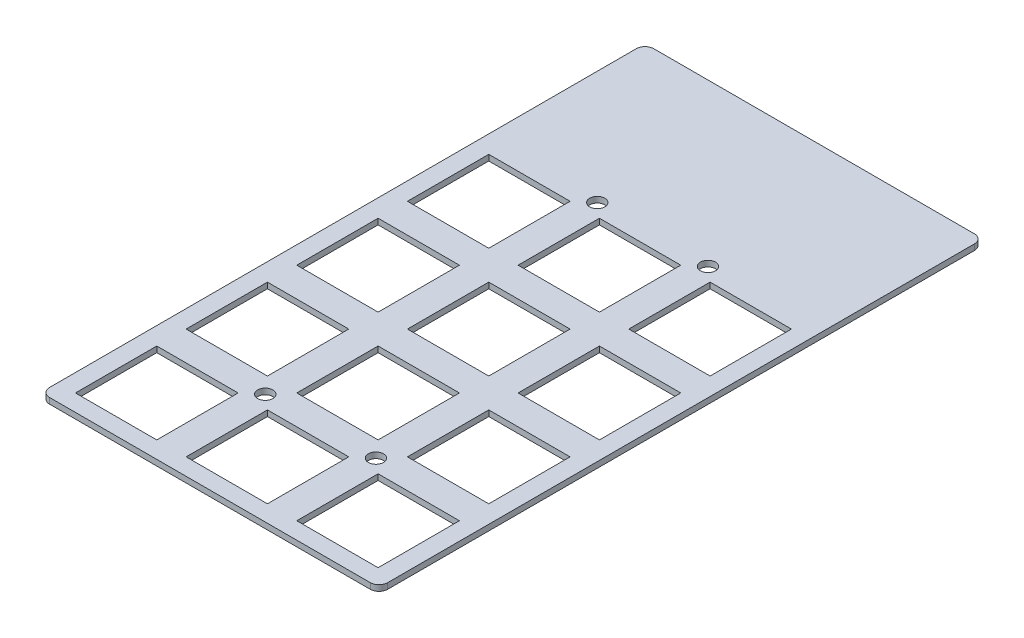
from build123d import *

# Parameters (mm, degrees)
SKETCH1_R           = 1.3
SKETCH1_W           = 14
SKETCH1_H           = 14
BOSS_EXTRUDE1_DEPTH = 1


with BuildPart() as part:
    # Sketch1 → Boss-Extrude1 (new body)
    with BuildSketch(Plane(origin=(0, 0, 0), x_dir=(1, 0, 0), z_dir=(0, 1, 0))):
        with BuildLine():
            Line((27.6, 52), (-27.6, 52))
            ThreePointArc((-27.6, 52), (-28.660660172, 51.560660172), (-29.1, 50.5))
            Line((-29.1, 50.5), (-29.1, -50.5))
            ThreePointArc((-29.1, -50.5), (-28.660660172, -51.560660172), (-27.6, -52))
            Line((-27.6, -52), (27.6, -52))
            ThreePointArc((27.6, -52), (28.660660172, -51.560660172), (29.1, -50.5))
            Line((29.1, -50.5), (29.1, 50.5))
            ThreePointArc((29.1, 50.5), (28.660660172, 51.560660172), (27.6, 52))
        make_face()
        with Locations(Location((-9.525, -32.95, 0), (0, 0, 270))):
            Circle(SKETCH1_R, mode=Mode.SUBTRACT)
        with Locations(Location((9.525, -32.95, 0), (0, 0, 270))):
            Circle(SKETCH1_R, mode=Mode.SUBTRACT)
        with Locations(Location((9.525, 24.2, 0), (0, 0, 270))):
            Circle(SKETCH1_R, mode=Mode.SUBTRACT)
        with Locations(Location((-9.525, 24.2, 0), (0, 0, 270))):
            Circle(SKETCH1_R, mode=Mode.SUBTRACT)
        with Locations((0, -42.1)):
            Rectangle(SKETCH1_W, SKETCH1_H, mode=Mode.SUBTRACT)
        with Locations((19.05, -42.1)):
            Rectangle(SKETCH1_W, SKETCH1_H, mode=Mode.SUBTRACT)
        with Locations((-19.05, -42.1)):
            Rectangle(SKETCH1_W, SKETCH1_H, mode=Mode.SUBTRACT)
        with Locations((-19.05, -23.05)):
            Rectangle(SKETCH1_W, SKETCH1_H, mode=Mode.SUBTRACT)
        with Locations((0, -23.05)):
            Rectangle(SKETCH1_W, SKETCH1_H, mode=Mode.SUBTRACT)
        with Locations((19.05, -23.05)):
            Rectangle(SKETCH1_W, SKETCH1_H, mode=Mode.SUBTRACT)
        with Locations((-19.05, -4)):
            Rectangle(SKETCH1_W, SKETCH1_H, mode=Mode.SUBTRACT)
        with Locations((0, -4)):
            Rectangle(SKETCH1_W, SKETCH1_H, mode=Mode.SUBTRACT)
        with Locations((19.05, -4)):
            Rectangle(SKETCH1_W, SKETCH1_H, mode=Mode.SUBTRACT)
        with Locations((-19.05, 15.05)):
            Rectangle(SKETCH1_W, SKETCH1_H, mode=Mode.SUBTRACT)
        with Locations((0, 15.05)):
            Rectangle(SKETCH1_W, SKETCH1_H, mode=Mode.SUBTRACT)
        with Locations((19.05, 15.05)):
            Rectangle(SKETCH1_W, SKETCH1_H, mode=Mode.SUBTRACT)
    extrude(amount=BOSS_EXTRUDE1_DEPTH)


solid = part.part
